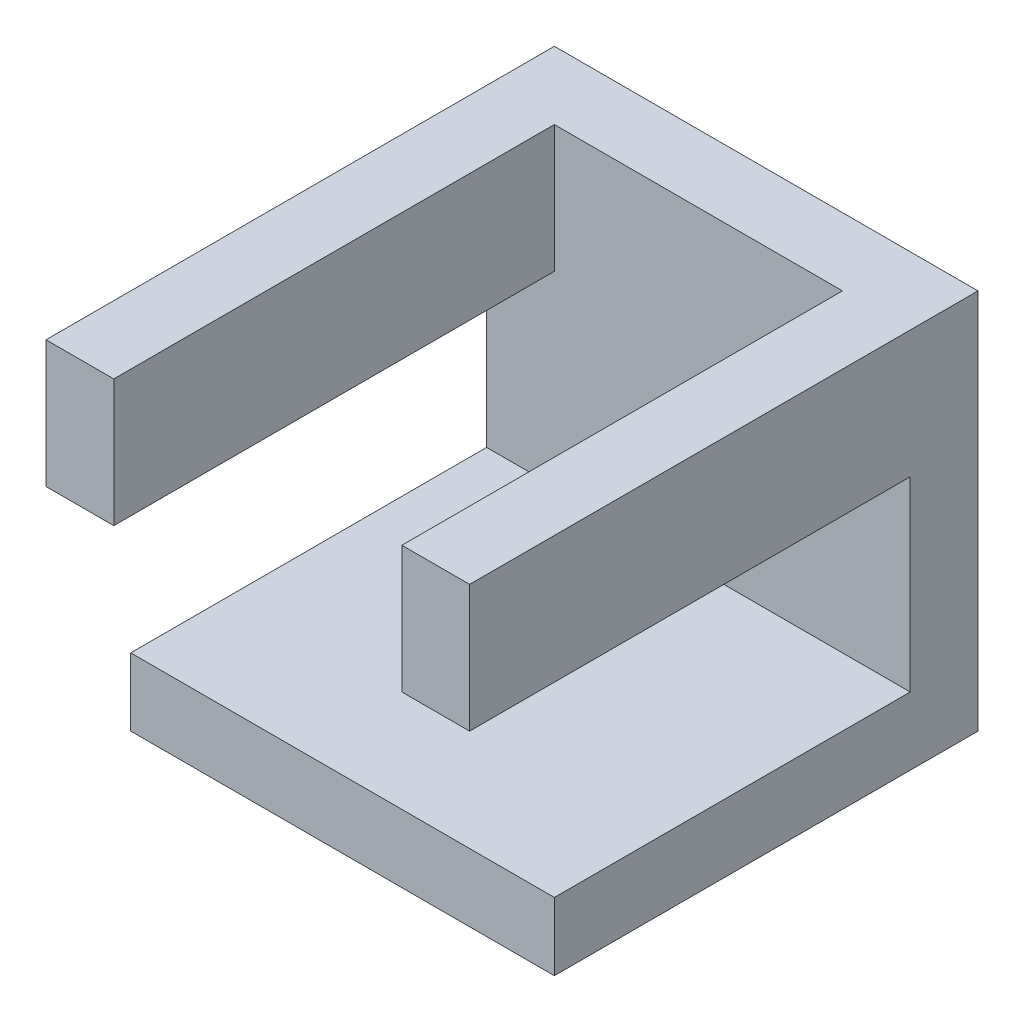
from build123d import *

# Parameters (mm, degrees)
SKETCH_1_W      = 500
SKETCH_1_H      = 450
EXTRUDE_1_DEPTH = 80
SKETCH_2_W      = 500
SKETCH_2_H      = 80
EXTRUDE_2_DEPTH = 500
SKETCH_3_W      = 80
SKETCH_3_H      = 150
EXTRUDE_3_DEPTH = 600
SKETCH_4_W      = 80
SKETCH_4_H      = 150
EXTRUDE_4_DEPTH = 600


with BuildPart() as part:
    # 草图1 → 凸台-拉伸1 (new body)
    with BuildSketch(Plane.XY):
        Rectangle(SKETCH_1_W, SKETCH_1_H)
    extrude(amount=EXTRUDE_1_DEPTH)

    # 草图2 → 凸台-拉伸2 (add)
    with BuildSketch(Plane.XY):
        with Locations((0, -185)):
            Rectangle(SKETCH_2_W, SKETCH_2_H)
    extrude(amount=EXTRUDE_2_DEPTH)

    # 草图3 → 凸台-拉伸3 (add)
    with BuildSketch(Plane.XY):
        with Locations((-210, 150)):
            Rectangle(SKETCH_3_W, SKETCH_3_H)
    extrude(amount=EXTRUDE_3_DEPTH)

    # 草图4 → 凸台-拉伸4 (add)
    with BuildSketch(Plane.XY):
        with Locations((210, 150)):
            Rectangle(SKETCH_4_W, SKETCH_4_H)
    extrude(amount=EXTRUDE_4_DEPTH)


solid = part.part
